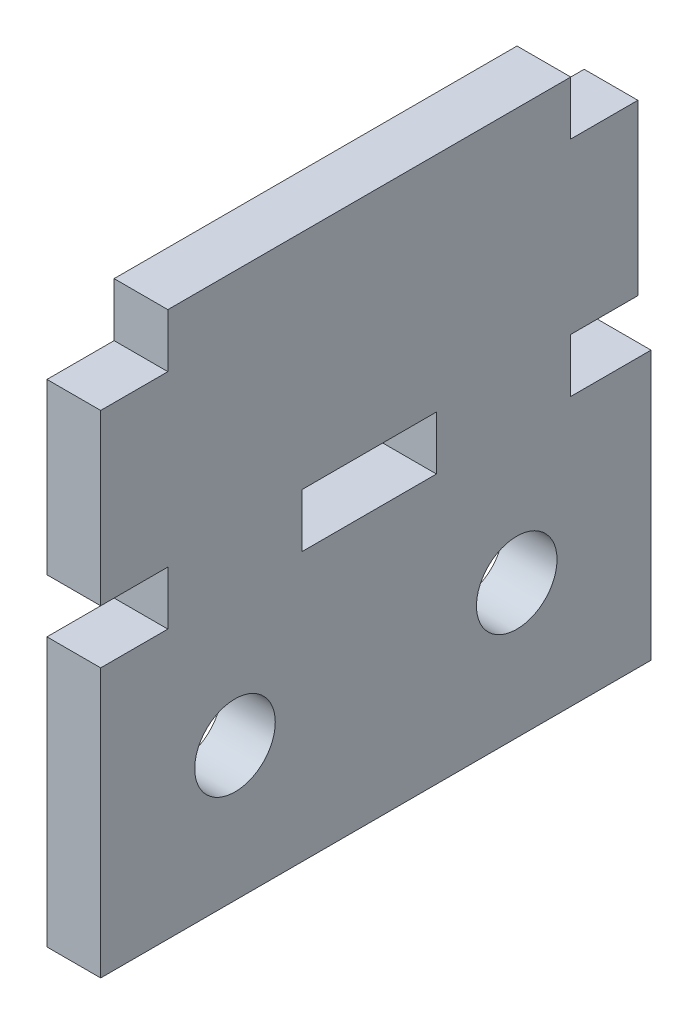
from build123d import *

# Parameters (mm, degrees)
BOSS_EXTRUDE1_DEPTH = 2
SKETCH2_R           = 1.5
BOSS_EXTRUDE2_DEPTH = 2
SKETCH3_W           = 5
SKETCH3_H           = 2
BOSS_EXTRUDE3_DEPTH = 2


with BuildPart() as part:
    # Sketch1 → Boss-Extrude1 (new body)
    with BuildSketch(Plane(origin=(0, 0, 0), x_dir=(0, 0, -1), z_dir=(1, 0, 0))):
        Polygon((-7.5, 3.15), (-7.5, 5.15), (-2.5, 5.15), (-2.5, 3.15), (2.5, 3.15), (2.5, 5.15), (7.5, 5.15), (7.5, 3.15), (10, 3.15), (10, -3.15), (7.5, -3.15), (7.5, -5.15), (2.5, -5.15), (2.5, -3.15), (-2.5, -3.15), (-2.5, -5.15), (-7.5, -5.15), (-7.5, -3.15), (-10, -3.15), (-10, 3.15), align=None)
    extrude(amount=BOSS_EXTRUDE1_DEPTH)

    # Sketch2 → Boss-Extrude2 (add)
    with BuildSketch(Plane(origin=(2, 0, 0), x_dir=(0, 0, -1), z_dir=(1, 0, 0))):
        Polygon((-10, -5.15), (-10, -15.15), (10.489374947, -15.15), (10.489374947, -5.15), (-7.5, -5.15), align=None)
        with Locations((-5, -10.15)):
            Circle(SKETCH2_R, mode=Mode.SUBTRACT)
        with Locations((5.489374947, -10.15)):
            Circle(SKETCH2_R, mode=Mode.SUBTRACT)
    extrude(amount=-BOSS_EXTRUDE2_DEPTH)

    # Sketch3 → Boss-Extrude3 (add)
    with BuildSketch(Plane(origin=(2, 0, 0), x_dir=(0, 0, -1), z_dir=(1, 0, 0))):
        with Locations((0, 4.15)):
            Rectangle(SKETCH3_W, SKETCH3_H)
    extrude(amount=-BOSS_EXTRUDE3_DEPTH)


solid = part.part
